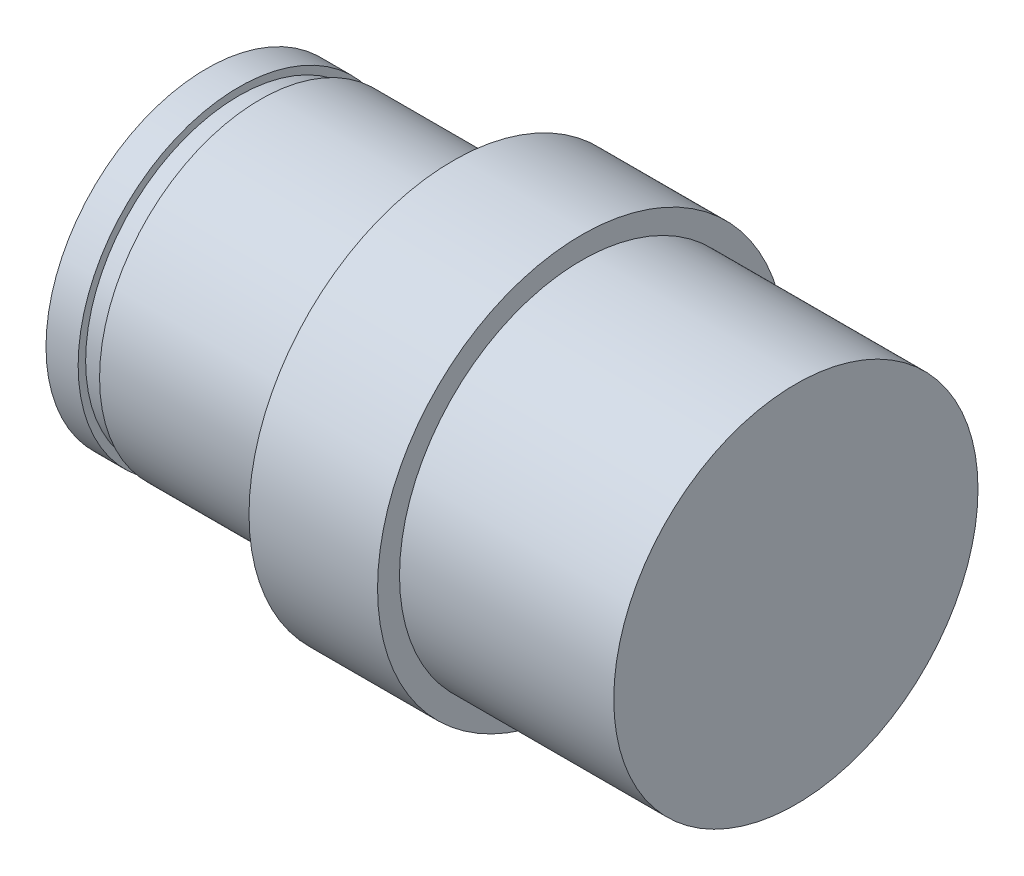
from build123d import *

# Parameters (mm, degrees)
ESBO_O2_W = 1
ESBO_O2_H = 0.35


with BuildPart() as part:
    # Esboço1 → Revolução1 (revolve)
    with BuildSketch(Plane.XY, mode=Mode.PRIVATE) as revolu_o1_sk:
        Polygon((0, 0), (0, 7.5), (11.5, 7.5), (11.5, 9.525), (17.5, 9.525), (17.5, 8.5), (27.5, 8.5), (27.5, 0), align=None)
    revolve(revolu_o1_sk.sketch.rotate(Axis((0, 0, 0), (1, 0, 0)), 90), axis=Axis((0, 0, 0), (1, 0, 0)))

    # Esboço2 → Corte-Revolução1 (revolve, cut)
    with BuildSketch(Plane.XY, mode=Mode.PRIVATE) as corte_revolu_o1_sk:
        with Locations((2, 7.325)):
            Rectangle(ESBO_O2_W, ESBO_O2_H)
    revolve(corte_revolu_o1_sk.sketch.rotate(Axis((0, 0, 0), (1, 0, 0)), 90), axis=Axis((0, 0, 0), (1, 0, 0)), mode=Mode.SUBTRACT)


solid = part.part
